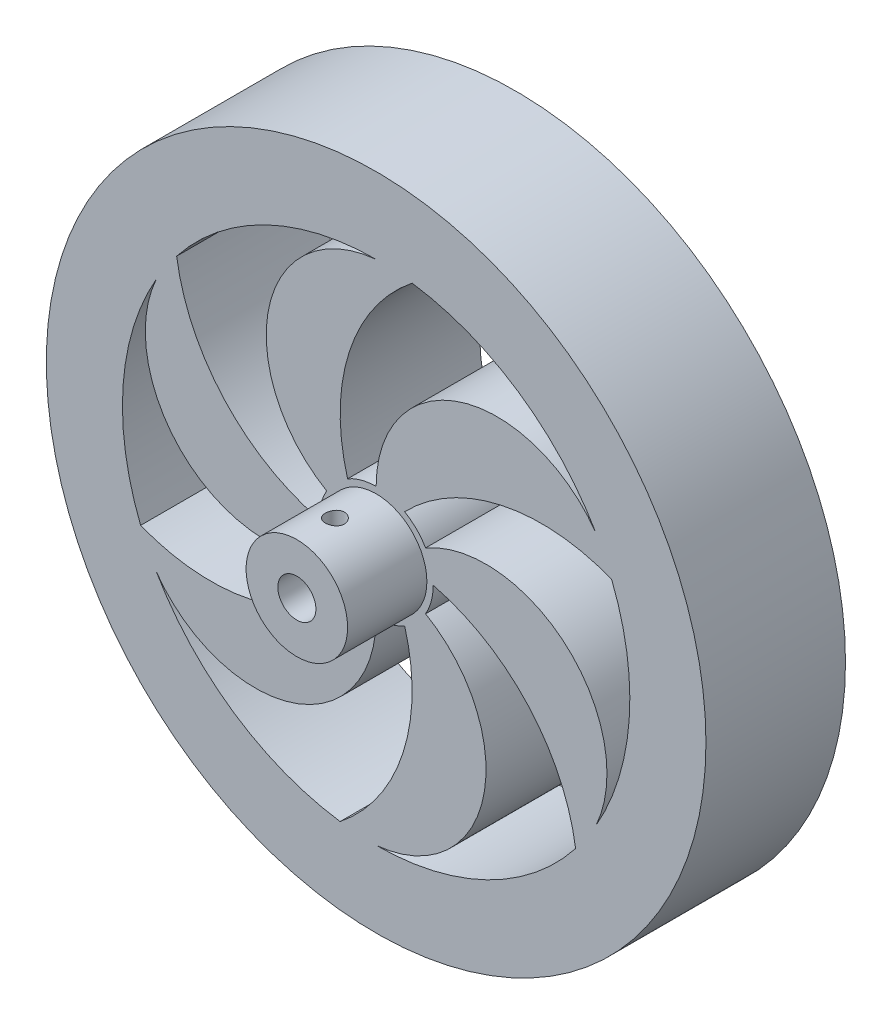
from build123d import *

# Parameters (mm, degrees)
SKETCH1_R             = 52
WHEEL_DEPTH           = 22
SKETCH2_R             = 8
BOSS_DEPTH            = 12.5
SKETCH3_R             = 3
BORE_DEPTH            = 12.3
SKETCH4_R             = 1.5
GRUB_SCREW_HOLE_DEPTH = 82.229612827
SPOKE_CUT_DEPTH       = 82.229612869
SPOKES_CUT_COUNT      = 6


with BuildPart() as part:
    # Sketch1 → wheel (new body)
    with BuildSketch(Plane.XY):
        Circle(SKETCH1_R)
    extrude(amount=WHEEL_DEPTH)

    # Sketch2 → boss (add)
    with BuildSketch(Plane.XY.offset(22)):
        Circle(SKETCH2_R)
    extrude(amount=BOSS_DEPTH)

    # Sketch3 → bore (cut)
    with BuildSketch(Plane.XY.offset(34.5)):
        Circle(SKETCH3_R)
    extrude(amount=-BORE_DEPTH, mode=Mode.SUBTRACT)

    # Sketch4 → grub screw hole (cut, through all)
    with BuildSketch(Plane(origin=(0, 0, 0), x_dir=(1, 0, 0), z_dir=(0, 1, 0))):
        with Locations(Location((0, -28.5, 0), (0, 0, 90))):
            Circle(SKETCH4_R)
    extrude(amount=GRUB_SCREW_HOLE_DEPTH, mode=Mode.SUBTRACT)

    # Sketch5 → spoke cut (cut, through all)
    with BuildSketch(Plane(origin=(0, 0, 0), x_dir=(-1, 0, 0), z_dir=(0, 0, -1))):
        with BuildLine():
            ThreePointArc((7.794228634, 4.5), (16.884139684, 25.101375915), (0, 40))
            ThreePointArc((0, 40), (17.484724527, 35.976164446), (31.451666243, 24.714220411))
            ThreePointArc((31.451666243, 24.714220411), (23.981825586, 8.94497388), (9, 0))
            ThreePointArc((9, 0), (8.693332437, 2.329371406), (7.794228634, 4.5))
        make_face()
    spoke_cut = extrude(amount=-SPOKE_CUT_DEPTH, mode=Mode.SUBTRACT)

    # spokes cut: spoke cut ×6 about axis
    spokes_cut_axis = Axis((0, 0, 0), (0, 0, 1))
    for i in range(1, SPOKES_CUT_COUNT):
        add(spoke_cut.rotate(spokes_cut_axis, i * 360 / SPOKES_CUT_COUNT), mode=Mode.SUBTRACT)


solid = part.part
